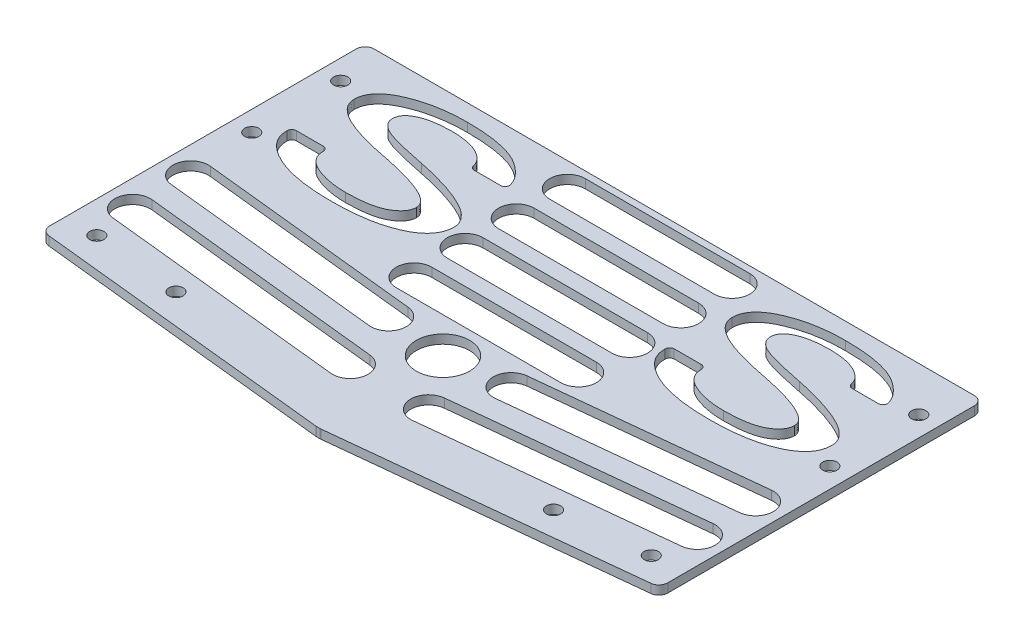
from build123d import *

# Parameters (mm, degrees)
SKETCH_1_W          = 139
SKETCH_1_H          = 80
EXTRUDE_1_DEPTH     = 2
CUT_EXTRUDE_1_DEPTH = 81.213776872
SKETCH_3_R          = 1.6
CUT_EXTRUDE_2_DEPTH = 10
CUT_EXTRUDE_3_DEPTH = 10
SKETCH_7_R          = 1.6
SKETCH_7_R_2        = 6
CUT_EXTRUDE_6_DEPTH = 10
CUT_EXTRUDE_7_DEPTH = 10
CUT_EXTRUDE_8_DEPTH = 10
FILLET_1_R          = 2
FILLET_2_R          = 1


with BuildPart() as part:
    # 草图1 → 凸台-拉伸1 (new body)
    with BuildSketch(Plane(origin=(0, 0, 0), x_dir=(1, 0, 0), z_dir=(0, 1, 0))):
        Rectangle(SKETCH_1_W, SKETCH_1_H)
    extrude(amount=EXTRUDE_1_DEPTH)

    # 草图2 → 切除-拉伸1 (cut, through all)
    with BuildSketch(Plane(origin=(0, 2, 0), x_dir=(1, 0, 0), z_dir=(0, 1, 0))):
        Polygon((0.5, -40), (69.5, -32.747807767), (69.5, -40), align=None)
        Polygon((-69.5, -40), (-0.5, -40), (-69.5, -32.747807767), align=None)
    extrude(amount=-CUT_EXTRUDE_1_DEPTH, mode=Mode.SUBTRACT)

    # 草图3 → 切除-拉伸2 (cut)
    with BuildSketch(Plane(origin=(0, 2, 0), x_dir=(1, 0, 0), z_dir=(0, 1, 0))):
        with Locations(Location((62.346454018, -27.502800964, 0), (0, 0, 270))):
            Circle(SKETCH_3_R)
        with Locations(Location((42.45601611, -29.593370229, 0), (0, 0, 270))):
            Circle(SKETCH_3_R)
        with Locations(Location((-42.45601611, -29.593370229, 0), (0, 0, 270))):
            Circle(SKETCH_3_R)
        with Locations(Location((-62.346454018, -27.502800964, 0), (0, 0, 270))):
            Circle(SKETCH_3_R)
    extrude(amount=-CUT_EXTRUDE_2_DEPTH, mode=Mode.SUBTRACT)

    # 草图4 → 切除-拉伸3 (cut)
    with BuildSketch(Plane(origin=(0, 2, 0), x_dir=(1, 0, 0), z_dir=(0, 1, 0))):
        with BuildLine():
            Line((-63.081886147, -14.317721403), (-8.383181902, -20.066786883))
            ThreePointArc((-8.383181902, -20.066786883), (-4.823208173, -24.462988318), (-9.219409608, -28.022962046))
            Line((-9.219409608, -28.022962046), (-63.918113853, -22.273896566))
            ThreePointArc((-63.918113853, -22.273896566), (-67.478087581, -17.877695132), (-63.081886147, -14.317721403))
        make_face()
        with BuildLine():
            Line((-63.081886147, -1.246113769), (-13.355791379, -6.472536932))
            ThreePointArc((-13.355791379, -6.472536932), (-9.79581765, -10.868738367), (-14.192019085, -14.428712095))
            Line((-14.192019085, -14.428712095), (-63.918113853, -9.202288932))
            ThreePointArc((-63.918113853, -9.202288932), (-67.478087581, -4.806087497), (-63.081886147, -1.246113769))
        make_face()
        with BuildLine():
            Line((63.081886147, -14.317721403), (8.383181902, -20.066786883))
            ThreePointArc((8.383181902, -20.066786883), (4.823208173, -24.462988318), (9.219409608, -28.022962046))
            Line((9.219409608, -28.022962046), (63.918113853, -22.273896566))
            ThreePointArc((63.918113853, -22.273896566), (67.478087581, -17.877695132), (63.081886147, -14.317721403))
        make_face()
        with BuildLine():
            Line((63.081886147, -1.246113769), (13.355791379, -6.472536932))
            ThreePointArc((13.355791379, -6.472536932), (9.79581765, -10.868738367), (14.192019085, -14.428712095))
            Line((14.192019085, -14.428712095), (63.918113853, -9.202288932))
            ThreePointArc((63.918113853, -9.202288932), (67.478087581, -4.806087497), (63.081886147, -1.246113769))
        make_face()
    extrude(amount=-CUT_EXTRUDE_3_DEPTH, mode=Mode.SUBTRACT)

    # 草图7 → 切除-拉伸6 (cut)
    with BuildSketch(Plane(origin=(0, 2, 0), x_dir=(1, 0, 0), z_dir=(0, 1, 0))):
        with Locations(Location((65, 30, 0), (0, 0, 270))):
            Circle(SKETCH_7_R)
        with Locations(Location((65, 10, 0), (0, 0, 270))):
            Circle(SKETCH_7_R)
        with Locations(Location((-65, 10, 0), (0, 0, 270))):
            Circle(SKETCH_7_R)
        with Locations(Location((-65, 30, 0), (0, 0, 270))):
            Circle(SKETCH_7_R)
        with Locations(Location((0, -12, 0), (0, 0, 270))):
            Circle(SKETCH_7_R_2)
    extrude(amount=-CUT_EXTRUDE_6_DEPTH, mode=Mode.SUBTRACT)

    # 草图8 → 切除-拉伸7 (cut)
    with BuildSketch(Plane(origin=(0, 2, 0), x_dir=(1, 0, 0), z_dir=(0, 1, 0))):
        with BuildLine():
            add(Edge.make_bspline(
                [(-23.798245614, 14.298245614), (-23.811984685, 13.969550227), (-23.839121165, 13.320333427), (-24.094601581, 12.376489507), (-24.490757532, 11.481255753), (-25.064210433, 10.648333256), (-25.788547212, 9.86992911), (-26.672680146, 9.146707991), (-27.711015066, 8.470370619), (-28.907517303, 7.860976916), (-30.236495089, 7.31368261), (-31.685096778, 6.8336749), (-33.247417413, 6.424381034), (-34.925925894, 6.098721941), (-36.716676421, 5.837182421), (-38.623202328, 5.661102329), (-40.64548644, 5.548358345), (-42.032871031, 5.53379661), (-42.745614035, 5.526315789)],
                knots=[0, 0, 0, 0, 0.689596208, 1.362043583, 2.040611843, 2.738869409, 3.47661473, 4.268764416, 5.133705226, 6.076426453, 7.086734824, 8.152060891, 9.281679619, 10.478954923, 11.744069304, 13.084031391, 14.501975414, 16, 16, 16, 16], degree=3))
            add(Edge.make_bspline(
                [(-42.745614035, 5.526315789), (-43.456228104, 5.533134417), (-44.839477821, 5.546407253), (-46.852948692, 5.668126698), (-48.747287834, 5.847578063), (-50.518177168, 6.124199638), (-52.173167257, 6.462640893), (-53.707029107, 6.885691259), (-55.125948915, 7.372419403), (-56.407330815, 7.953494235), (-57.560686491, 8.577373047), (-58.563672713, 9.252273539), (-59.420514782, 9.959800486), (-60.118625709, 10.713105812), (-60.66938687, 11.504227208), (-61.059019296, 12.340976064), (-61.296744244, 13.219607245), (-61.326912733, 13.820303007), (-61.342105263, 14.122807018)],
                knots=[0, 0, 0, 0, 1.528042826, 2.974420149, 4.336579627, 5.61854005, 6.827125088, 7.967318582, 9.038278336, 10.049426305, 10.989558411, 11.855123833, 12.645332834, 13.373827097, 14.057283863, 14.709554501, 15.350145342, 16, 16, 16, 16], degree=3))
            Line((-61.342105263, 14.122807018), (-61.342105263, 15.350877193))
            Line((-61.342105263, 15.350877193), (-53.271929825, 15.350877193))
            Line((-53.271929825, 15.350877193), (-53.271929825, 14.298245614))
            add(Edge.make_bspline(
                [(-53.271929825, 14.298245614), (-53.261006465, 14.085279516), (-53.239466281, 13.665323647), (-53.096549674, 13.053973265), (-52.842229345, 12.483342626), (-52.488159304, 11.956063524), (-52.035677101, 11.469449757), (-51.49095236, 11.017871941), (-50.842243109, 10.610566713), (-50.104631273, 10.249101387), (-49.308417508, 9.919383792), (-48.46449764, 9.646356097), (-47.594323611, 9.390995912), (-46.684578849, 9.204919921), (-45.747382076, 9.041418316), (-44.77420053, 8.946787967), (-43.771413007, 8.866265086), (-43.090174803, 8.861871392), (-42.745614035, 8.859649123)],
                knots=[0, 0, 0, 0, 0.786105305, 1.550150651, 2.301840246, 3.080141708, 3.883618048, 4.746547653, 5.684712976, 6.70370847, 7.775649798, 8.862778249, 9.976337348, 11.121031164, 12.288175347, 13.486262125, 14.728586494, 16, 16, 16, 16], degree=3))
            add(Edge.make_bspline(
                [(-42.745614035, 8.859649123), (-42.292879065, 8.865550617), (-41.419421184, 8.876936322), (-40.155146734, 8.938107286), (-38.984260245, 9.054951478), (-37.904108477, 9.216190842), (-36.914198099, 9.417680594), (-36.021891772, 9.681926921), (-35.216188504, 9.972230313), (-34.511520001, 10.328894188), (-33.892829788, 10.711072448), (-33.355499436, 11.115780491), (-32.895943261, 11.536559797), (-32.522481396, 11.980048806), (-32.228440202, 12.442405843), (-32.020130912, 12.924440254), (-31.888237225, 13.429230404), (-31.875078605, 13.773291861), (-31.868421053, 13.947368421)],
                knots=[0, 0, 0, 0, 1.653344362, 3.189783776, 4.620556657, 5.948304816, 7.176869904, 8.305683839, 9.344333556, 10.299361919, 11.183859644, 11.996940827, 12.752474708, 13.454265448, 14.108206399, 14.745873757, 15.365479693, 16, 16, 16, 16], degree=3))
            add(Edge.make_bspline(
                [(-31.868421053, 13.947368421), (-31.879454674, 14.093615733), (-31.901709349, 14.388594699), (-32.05558236, 14.825314964), (-32.307568096, 15.248013793), (-32.658845229, 15.662859455), (-33.117235324, 16.053394365), (-33.656964884, 16.455273064), (-34.306154334, 16.832883665), (-35.047124353, 17.20741106), (-35.878966033, 17.578570158), (-36.804454765, 17.929443309), (-37.811230334, 18.291172066), (-38.908969594, 18.632533422), (-40.096093083, 18.960897195), (-41.366086607, 19.294499616), (-42.72752592, 19.61143658), (-43.665763898, 19.809990321), (-44.149122807, 19.912280702)],
                knots=[0, 0, 0, 0, 0.490673897, 0.989683008, 1.537199693, 2.135879917, 2.80559991, 3.554634411, 4.392695868, 5.322809008, 6.341722852, 7.449073439, 8.645064034, 9.93302111, 11.307475234, 12.780215213, 14.341239966, 16, 16, 16, 16], degree=3))
            add(Edge.make_bspline(
                [(-44.149122807, 19.912280702), (-44.827587199, 20.043922834), (-46.134984979, 20.297596621), (-48.018063723, 20.707263575), (-49.754048927, 21.127658855), (-51.34242039, 21.560824921), (-52.784686585, 22.001549705), (-54.078495926, 22.452369253), (-55.223377679, 22.919312978), (-56.229171015, 23.392652582), (-57.100207931, 23.888390638), (-57.855081797, 24.402229693), (-58.496251337, 24.937485587), (-59.016977915, 25.502207417), (-59.428582487, 26.085649972), (-59.727404789, 26.693330826), (-59.903692605, 27.331584343), (-59.926925221, 27.764815598), (-59.938596491, 27.98245614)],
                knots=[0, 0, 0, 0, 1.763446546, 3.398153428, 4.916861916, 6.320605123, 7.598500997, 8.764358757, 9.815291428, 10.752182182, 11.598767947, 12.369847243, 13.079605595, 13.724992431, 14.324447516, 14.895431967, 15.445102856, 16, 16, 16, 16], degree=3))
            add(Edge.make_bspline(
                [(-59.938596491, 27.98245614), (-59.924485645, 28.283060602), (-59.896409948, 28.881159346), (-59.641872977, 29.750557081), (-59.240692538, 30.576614984), (-58.668911406, 31.349079696), (-57.9418223, 32.073307844), (-57.062662365, 32.757992944), (-56.020675997, 33.392813207), (-54.835524774, 33.971111429), (-53.5440442, 34.496709742), (-52.1811181, 34.966782715), (-50.754062723, 35.354521704), (-49.267566135, 35.670795763), (-47.722311622, 35.927786894), (-46.114288466, 36.09564619), (-44.44979387, 36.214034885), (-43.319799947, 36.223341293), (-42.745614035, 36.228070175)],
                knots=[0, 0, 0, 0, 0.695001382, 1.382811991, 2.080668937, 2.813264719, 3.597330563, 4.451467487, 5.388576634, 6.418494566, 7.503022696, 8.616865204, 9.756147842, 10.926213897, 12.136259338, 13.382916658, 14.670176578, 16, 16, 16, 16], degree=3))
            add(Edge.make_bspline(
                [(-42.745614035, 36.228070175), (-42.011212802, 36.218730001), (-40.595470775, 36.20072448), (-38.550111751, 36.080801586), (-36.664989191, 35.868950497), (-34.936832173, 35.573580834), (-33.365423224, 35.193841714), (-31.950462083, 34.729925314), (-30.692258291, 34.18232488), (-29.600060193, 33.538172352), (-28.657922207, 32.846002404), (-27.827086956, 32.154209262), (-27.135432474, 31.433137751), (-26.555776585, 30.707771168), (-26.106127608, 29.961562507), (-25.78986452, 29.197365573), (-25.592363124, 28.419076981), (-25.56580009, 27.892585071), (-25.552631579, 27.631578947)],
                knots=[0, 0, 0, 0, 1.676016361, 3.230940654, 4.673646357, 6.00311544, 7.229544263, 8.359664627, 9.397554113, 10.354662417, 11.246477528, 12.063560338, 12.818651168, 13.522704578, 14.178833135, 14.79936501, 15.404790315, 16, 16, 16, 16], degree=3))
            Line((-25.552631579, 27.631578947), (-33.622807018, 27.631578947))
            add(Edge.make_bspline(
                [(-33.622807018, 27.631578947), (-33.601039446, 27.789451545), (-33.557799754, 28.103053942), (-33.610234854, 28.577618211), (-33.74164582, 29.042320724), (-33.966551308, 29.491908339), (-34.280803229, 29.927282291), (-34.68039318, 30.34847143), (-35.168509243, 30.758786103), (-35.735348221, 31.158910872), (-36.380770524, 31.526198311), (-37.097380054, 31.845525447), (-37.877362772, 32.118166198), (-38.725953719, 32.335567146), (-39.636944168, 32.511965237), (-40.615927223, 32.633458424), (-41.65945746, 32.703490926), (-42.377301018, 32.713938022), (-42.745614035, 32.719298246)],
                knots=[0, 0, 0, 0, 0.654878433, 1.300868228, 1.95098029, 2.637892244, 3.361440756, 4.157461838, 5.025325033, 5.986615272, 7.014493908, 8.08169142, 9.217028207, 10.41697244, 11.690206645, 13.040406016, 14.481483912, 16, 16, 16, 16], degree=3))
            add(Edge.make_bspline(
                [(-42.745614035, 32.719298246), (-43.087881329, 32.715124772), (-43.753326327, 32.707010595), (-44.724768622, 32.656641941), (-45.639351758, 32.564833564), (-46.503104182, 32.443674972), (-47.309833522, 32.282030698), (-48.064078112, 32.088790248), (-48.759906151, 31.853307789), (-49.40256769, 31.59090626), (-49.977163665, 31.295848853), (-50.478597892, 30.974988976), (-50.906026242, 30.632381254), (-51.254215841, 30.257031427), (-51.53527914, 29.860719924), (-51.722844942, 29.428459343), (-51.846913332, 28.977019343), (-51.861220572, 28.665534528), (-51.868421053, 28.50877193)],
                knots=[0, 0, 0, 0, 1.496324264, 2.909192657, 4.250844308, 5.513594068, 6.720621228, 7.845963384, 8.914920493, 9.929530476, 10.878150575, 11.734374499, 12.528504388, 13.265483187, 13.966742554, 14.640685222, 15.315890516, 16, 16, 16, 16], degree=3))
            add(Edge.make_bspline(
                [(-51.868421053, 28.50877193), (-51.862044553, 28.378218034), (-51.849451881, 28.12039285), (-51.751818738, 27.741878898), (-51.603990528, 27.377119917), (-51.388837899, 27.026200281), (-51.116180537, 26.689517978), (-50.779200558, 26.370387081), (-50.385604131, 26.063529826), (-49.912977996, 25.758974335), (-49.309091959, 25.458064058), (-48.532411376, 25.161027284), (-47.568888468, 24.845310572), (-46.4153816, 24.515508837), (-45.068285878, 24.175627124), (-43.531629572, 23.809923486), (-41.798921151, 23.443894683), (-40.579926135, 23.199011676), (-39.938596491, 23.070175439)],
                knots=[0, 0, 0, 0, 0.45070226, 0.890072202, 1.343254272, 1.806706677, 2.307077885, 2.836506699, 3.407047119, 4.029986259, 4.776538077, 5.734305519, 6.90133961, 8.280223379, 9.879759942, 11.702737764, 13.739152642, 16, 16, 16, 16], degree=3))
            add(Edge.make_bspline(
                [(-39.938596491, 23.070175439), (-39.311987079, 22.938917788), (-38.094573372, 22.683902686), (-36.328070583, 22.261501861), (-34.67421601, 21.811870901), (-33.125435105, 21.35384652), (-31.688005478, 20.874138361), (-30.359272327, 20.373517003), (-29.138672641, 19.858061168), (-28.031049183, 19.320295624), (-27.044670657, 18.764473085), (-26.17796517, 18.197780287), (-25.450766863, 17.59752328), (-24.853713614, 16.97955618), (-24.379197513, 16.343482198), (-24.043648496, 15.682971685), (-23.835170849, 14.997321203), (-23.810561141, 14.531405519), (-23.798245614, 14.298245614)],
                knots=[0, 0, 0, 0, 1.58246573, 3.074507709, 4.488834363, 5.818539533, 7.066306433, 8.23370189, 9.327564062, 10.34040292, 11.275411277, 12.124767603, 12.89663125, 13.600941361, 14.244516851, 14.85028228, 15.42464252, 16, 16, 16, 16], degree=3))
        make_face()
        with BuildLine():
            add(Edge.make_bspline(
                [(61.201754386, 14.298245614), (61.188015315, 13.969550227), (61.160878835, 13.320333427), (60.905398419, 12.376489507), (60.509242468, 11.481255753), (59.935789567, 10.648333256), (59.211452788, 9.86992911), (58.327319854, 9.146707991), (57.288984934, 8.470370619), (56.092482697, 7.860976916), (54.763504911, 7.31368261), (53.314903222, 6.8336749), (51.752582587, 6.424381034), (50.074074106, 6.098721941), (48.283323579, 5.837182421), (46.376797672, 5.661102329), (44.35451356, 5.548358345), (42.967128969, 5.53379661), (42.254385965, 5.526315789)],
                knots=[0, 0, 0, 0, 0.689596208, 1.362043583, 2.040611843, 2.738869409, 3.47661473, 4.268764416, 5.133705226, 6.076426453, 7.086734824, 8.152060891, 9.281679619, 10.478954923, 11.744069304, 13.084031391, 14.501975414, 16, 16, 16, 16], degree=3))
            add(Edge.make_bspline(
                [(42.254385965, 5.526315789), (41.543771896, 5.533134417), (40.160522179, 5.546407253), (38.147051308, 5.668126698), (36.252712166, 5.847578063), (34.481822832, 6.124199638), (32.826832743, 6.462640893), (31.292970893, 6.885691259), (29.874051085, 7.372419403), (28.592669185, 7.953494235), (27.439313509, 8.577373047), (26.436327287, 9.252273539), (25.579485218, 9.959800486), (24.881374291, 10.713105812), (24.33061313, 11.504227208), (23.940980704, 12.340976064), (23.703255756, 13.219607245), (23.673087267, 13.820303007), (23.657894737, 14.122807018)],
                knots=[0, 0, 0, 0, 1.528042826, 2.974420149, 4.336579627, 5.61854005, 6.827125088, 7.967318582, 9.038278336, 10.049426305, 10.989558411, 11.855123833, 12.645332834, 13.373827097, 14.057283863, 14.709554501, 15.350145342, 16, 16, 16, 16], degree=3))
            Line((23.657894737, 14.122807018), (23.657894737, 15.350877193))
            Line((23.657894737, 15.350877193), (31.728070175, 15.350877193))
            Line((31.728070175, 15.350877193), (31.728070175, 14.298245614))
            add(Edge.make_bspline(
                [(31.728070175, 14.298245614), (31.738993535, 14.085279516), (31.760533719, 13.665323647), (31.903450326, 13.053973265), (32.157770655, 12.483342626), (32.511840696, 11.956063524), (32.964322899, 11.469449757), (33.50904764, 11.017871941), (34.157756891, 10.610566713), (34.895368727, 10.249101387), (35.691582492, 9.919383792), (36.53550236, 9.646356097), (37.405676389, 9.390995912), (38.315421151, 9.204919921), (39.252617924, 9.041418316), (40.22579947, 8.946787967), (41.228586993, 8.866265086), (41.909825197, 8.861871392), (42.254385965, 8.859649123)],
                knots=[0, 0, 0, 0, 0.786105305, 1.550150651, 2.301840246, 3.080141708, 3.883618048, 4.746547653, 5.684712976, 6.70370847, 7.775649798, 8.862778249, 9.976337348, 11.121031164, 12.288175347, 13.486262125, 14.728586494, 16, 16, 16, 16], degree=3))
            add(Edge.make_bspline(
                [(42.254385965, 8.859649123), (42.707120935, 8.865550617), (43.580578816, 8.876936322), (44.844853266, 8.938107286), (46.015739755, 9.054951478), (47.095891523, 9.216190842), (48.085801901, 9.417680594), (48.978108228, 9.681926921), (49.783811496, 9.972230313), (50.488479999, 10.328894188), (51.107170212, 10.711072448), (51.644500564, 11.115780491), (52.104056739, 11.536559797), (52.477518604, 11.980048806), (52.771559798, 12.442405843), (52.979869088, 12.924440254), (53.111762775, 13.429230404), (53.124921395, 13.773291861), (53.131578947, 13.947368421)],
                knots=[0, 0, 0, 0, 1.653344362, 3.189783776, 4.620556657, 5.948304816, 7.176869904, 8.305683839, 9.344333556, 10.299361919, 11.183859644, 11.996940827, 12.752474708, 13.454265448, 14.108206399, 14.745873757, 15.365479693, 16, 16, 16, 16], degree=3))
            add(Edge.make_bspline(
                [(53.131578947, 13.947368421), (53.120545326, 14.093615733), (53.098290651, 14.388594699), (52.94441764, 14.825314964), (52.692431904, 15.248013793), (52.341154771, 15.662859455), (51.882764676, 16.053394365), (51.343035116, 16.455273064), (50.693845666, 16.832883665), (49.952875647, 17.20741106), (49.121033967, 17.578570158), (48.195545235, 17.929443309), (47.188769666, 18.291172066), (46.091030406, 18.632533422), (44.903906917, 18.960897195), (43.633913393, 19.294499616), (42.27247408, 19.61143658), (41.334236102, 19.809990321), (40.850877193, 19.912280702)],
                knots=[0, 0, 0, 0, 0.490673897, 0.989683008, 1.537199693, 2.135879917, 2.80559991, 3.554634411, 4.392695868, 5.322809008, 6.341722852, 7.449073439, 8.645064034, 9.93302111, 11.307475234, 12.780215213, 14.341239966, 16, 16, 16, 16], degree=3))
            add(Edge.make_bspline(
                [(40.850877193, 19.912280702), (40.172412801, 20.043922834), (38.865015021, 20.297596621), (36.981936277, 20.707263575), (35.245951073, 21.127658855), (33.65757961, 21.560824921), (32.215313415, 22.001549705), (30.921504074, 22.452369253), (29.776622321, 22.919312978), (28.770828985, 23.392652582), (27.899792069, 23.888390638), (27.144918203, 24.402229693), (26.503748663, 24.937485587), (25.983022085, 25.502207417), (25.571417513, 26.085649972), (25.272595211, 26.693330826), (25.096307395, 27.331584343), (25.073074779, 27.764815598), (25.061403509, 27.98245614)],
                knots=[0, 0, 0, 0, 1.763446546, 3.398153428, 4.916861916, 6.320605123, 7.598500997, 8.764358757, 9.815291428, 10.752182182, 11.598767947, 12.369847243, 13.079605595, 13.724992431, 14.324447516, 14.895431967, 15.445102856, 16, 16, 16, 16], degree=3))
            add(Edge.make_bspline(
                [(25.061403509, 27.98245614), (25.075514355, 28.283060602), (25.103590052, 28.881159346), (25.358127023, 29.750557081), (25.759307462, 30.576614984), (26.331088594, 31.349079696), (27.0581777, 32.073307844), (27.937337635, 32.757992944), (28.979324003, 33.392813207), (30.164475226, 33.971111429), (31.4559558, 34.496709742), (32.8188819, 34.966782715), (34.245937277, 35.354521704), (35.732433865, 35.670795763), (37.277688378, 35.927786894), (38.885711534, 36.09564619), (40.55020613, 36.214034885), (41.680200053, 36.223341293), (42.254385965, 36.228070175)],
                knots=[0, 0, 0, 0, 0.695001382, 1.382811991, 2.080668937, 2.813264719, 3.597330563, 4.451467487, 5.388576634, 6.418494566, 7.503022696, 8.616865204, 9.756147842, 10.926213897, 12.136259338, 13.382916658, 14.670176578, 16, 16, 16, 16], degree=3))
            add(Edge.make_bspline(
                [(42.254385965, 36.228070175), (42.988787198, 36.218730001), (44.404529225, 36.20072448), (46.449888249, 36.080801586), (48.335010809, 35.868950497), (50.063167827, 35.573580834), (51.634576776, 35.193841714), (53.049537917, 34.729925314), (54.307741709, 34.18232488), (55.399939807, 33.538172352), (56.342077793, 32.846002404), (57.172913044, 32.154209262), (57.864567526, 31.433137751), (58.444223415, 30.707771168), (58.893872392, 29.961562507), (59.21013548, 29.197365573), (59.407636876, 28.419076981), (59.43419991, 27.892585071), (59.447368421, 27.631578947)],
                knots=[0, 0, 0, 0, 1.676016361, 3.230940654, 4.673646357, 6.00311544, 7.229544263, 8.359664627, 9.397554113, 10.354662417, 11.246477528, 12.063560338, 12.818651168, 13.522704578, 14.178833135, 14.79936501, 15.404790315, 16, 16, 16, 16], degree=3))
            Line((59.447368421, 27.631578947), (51.377192982, 27.631578947))
            add(Edge.make_bspline(
                [(51.377192982, 27.631578947), (51.398960554, 27.789451545), (51.442200246, 28.103053942), (51.389765146, 28.577618211), (51.25835418, 29.042320724), (51.033448692, 29.491908339), (50.719196771, 29.927282291), (50.31960682, 30.34847143), (49.831490757, 30.758786103), (49.264651779, 31.158910872), (48.619229476, 31.526198311), (47.902619946, 31.845525447), (47.122637228, 32.118166198), (46.274046281, 32.335567146), (45.363055832, 32.511965237), (44.384072777, 32.633458424), (43.34054254, 32.703490926), (42.622698982, 32.713938022), (42.254385965, 32.719298246)],
                knots=[0, 0, 0, 0, 0.654878433, 1.300868228, 1.95098029, 2.637892244, 3.361440756, 4.157461838, 5.025325033, 5.986615272, 7.014493908, 8.08169142, 9.217028207, 10.41697244, 11.690206645, 13.040406016, 14.481483912, 16, 16, 16, 16], degree=3))
            add(Edge.make_bspline(
                [(42.254385965, 32.719298246), (41.912118671, 32.715124772), (41.246673673, 32.707010595), (40.275231378, 32.656641941), (39.360648242, 32.564833564), (38.496895818, 32.443674972), (37.690166478, 32.282030698), (36.935921888, 32.088790248), (36.240093849, 31.853307789), (35.59743231, 31.59090626), (35.022836335, 31.295848853), (34.521402108, 30.974988976), (34.093973758, 30.632381254), (33.745784159, 30.257031427), (33.46472086, 29.860719924), (33.277155058, 29.428459343), (33.153086668, 28.977019343), (33.138779428, 28.665534528), (33.131578947, 28.50877193)],
                knots=[0, 0, 0, 0, 1.496324264, 2.909192657, 4.250844308, 5.513594068, 6.720621228, 7.845963384, 8.914920493, 9.929530476, 10.878150575, 11.734374499, 12.528504388, 13.265483187, 13.966742554, 14.640685222, 15.315890516, 16, 16, 16, 16], degree=3))
            add(Edge.make_bspline(
                [(33.131578947, 28.50877193), (33.137955447, 28.378218034), (33.150548119, 28.12039285), (33.248181262, 27.741878898), (33.396009472, 27.377119917), (33.611162101, 27.026200281), (33.883819463, 26.689517978), (34.220799442, 26.370387081), (34.614395869, 26.063529826), (35.087022004, 25.758974335), (35.690908041, 25.458064058), (36.467588624, 25.161027284), (37.431111532, 24.845310572), (38.5846184, 24.515508837), (39.931714122, 24.175627124), (41.468370428, 23.809923486), (43.201078849, 23.443894683), (44.420073865, 23.199011676), (45.061403509, 23.070175439)],
                knots=[0, 0, 0, 0, 0.45070226, 0.890072202, 1.343254272, 1.806706677, 2.307077885, 2.836506699, 3.407047119, 4.029986259, 4.776538077, 5.734305519, 6.90133961, 8.280223379, 9.879759942, 11.702737764, 13.739152642, 16, 16, 16, 16], degree=3))
            add(Edge.make_bspline(
                [(45.061403509, 23.070175439), (45.688012921, 22.938917788), (46.905426628, 22.683902686), (48.671929417, 22.261501861), (50.32578399, 21.811870901), (51.874564895, 21.35384652), (53.311994522, 20.874138361), (54.640727673, 20.373517003), (55.861327359, 19.858061168), (56.968950817, 19.320295624), (57.955329343, 18.764473085), (58.82203483, 18.197780287), (59.549233137, 17.59752328), (60.146286386, 16.97955618), (60.620802487, 16.343482198), (60.956351504, 15.682971685), (61.164829151, 14.997321203), (61.189438859, 14.531405519), (61.201754386, 14.298245614)],
                knots=[0, 0, 0, 0, 1.58246573, 3.074507709, 4.488834363, 5.818539533, 7.066306433, 8.23370189, 9.327564062, 10.34040292, 11.275411277, 12.124767603, 12.89663125, 13.600941361, 14.244516851, 14.85028228, 15.42464252, 16, 16, 16, 16], degree=3))
        make_face()
    extrude(amount=-CUT_EXTRUDE_7_DEPTH, mode=Mode.SUBTRACT)

    # 草图9 → 切除-拉伸8 (cut)
    with BuildSketch(Plane(origin=(0, 2, 0), x_dir=(1, 0, 0), z_dir=(0, 1, 0))):
        with BuildLine():
            Line((-18.5, 4), (18.5, 4))
            ThreePointArc((18.5, 4), (22.5, 0), (18.5, -4))
            Line((18.5, -4), (-18.5, -4))
            ThreePointArc((-18.5, -4), (-22.5, 0), (-18.5, 4))
        make_face()
        with BuildLine():
            Line((-18.5, 15.5), (18.5, 15.5))
            ThreePointArc((18.5, 15.5), (22.5, 11.5), (18.5, 7.5))
            Line((18.5, 7.5), (-18.5, 7.5))
            ThreePointArc((-18.5, 7.5), (-22.5, 11.5), (-18.5, 15.5))
        make_face()
        with BuildLine():
            Line((-18.5, 27), (18.5, 27))
            ThreePointArc((18.5, 27), (22.5, 23), (18.5, 19))
            Line((18.5, 19), (-18.5, 19))
            ThreePointArc((-18.5, 19), (-22.5, 23), (-18.5, 27))
        make_face()
        with BuildLine():
            Line((-18.5, 38.5), (18.5, 38.5))
            ThreePointArc((18.5, 38.5), (22.5, 34.5), (18.5, 30.5))
            Line((18.5, 30.5), (-18.5, 30.5))
            ThreePointArc((-18.5, 30.5), (-22.5, 34.5), (-18.5, 38.5))
        make_face()
    extrude(amount=-CUT_EXTRUDE_8_DEPTH, mode=Mode.SUBTRACT)

    # 圆角1
    fillet_1_edges = [part.edges().sort_by_distance(p)[0] for p in [
        (0.5, 1, 40),
        (69.5, 1, 32.747807767),
        (-69.5, 1, 32.747807767),
        (-0.5, 1, 40),
        (-69.5, 1, -40),
        (69.5, 1, -40),
    ]]
    fillet(fillet_1_edges, radius=FILLET_1_R)

    # 圆角2
    fillet_2_edges = [part.edges().sort_by_distance(p)[0] for p in [
        (-61.342105263, 1, -15.350877193),
        (-53.271929825, 1, -15.350877193),
        (-25.552631579, 1, -27.631578947),
        (-33.622807018, 1, -27.631578947),
        (23.657894737, 1, -15.350877193),
        (31.728070175, 1, -15.350877193),
        (59.447368421, 1, -27.631578947),
        (51.377192982, 1, -27.631578947),
    ]]
    fillet(fillet_2_edges, radius=FILLET_2_R)


solid = part.part
